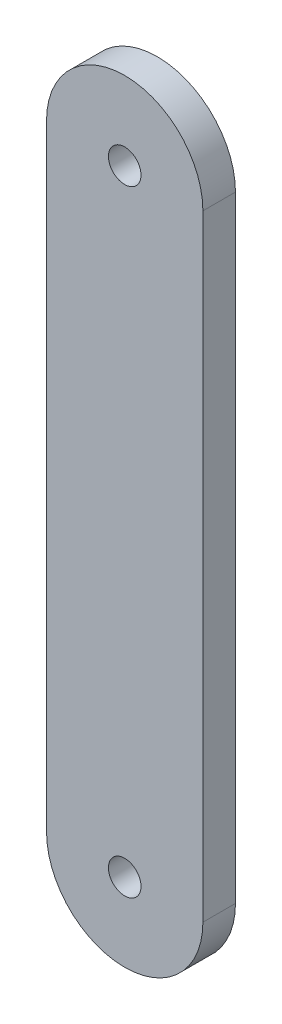
from build123d import *

# Parameters (mm, degrees)
SKETCH_1_R      = 2.5
EXTRUDE_1_DEPTH = 5


with BuildPart() as part:
    # 草图1 → 凸台-拉伸1 (new body)
    with BuildSketch(Plane.XY.offset(5)):
        with BuildLine():
            Line((12, -47.28), (12, 47.28))
            ThreePointArc((12, 47.28), (0, 59.28), (-12, 47.28))
            Line((-12, 47.28), (-12, -47.28))
            ThreePointArc((-12, -47.28), (0, -59.28), (12, -47.28))
        make_face()
        with Locations(Location((0, -47.28, 0), (0, 0, 180))):
            Circle(SKETCH_1_R, mode=Mode.SUBTRACT)
        with Locations(Location((0, 47.28, 0), (0, 0, 180))):
            Circle(SKETCH_1_R, mode=Mode.SUBTRACT)
    extrude(amount=-EXTRUDE_1_DEPTH)


solid = part.part
